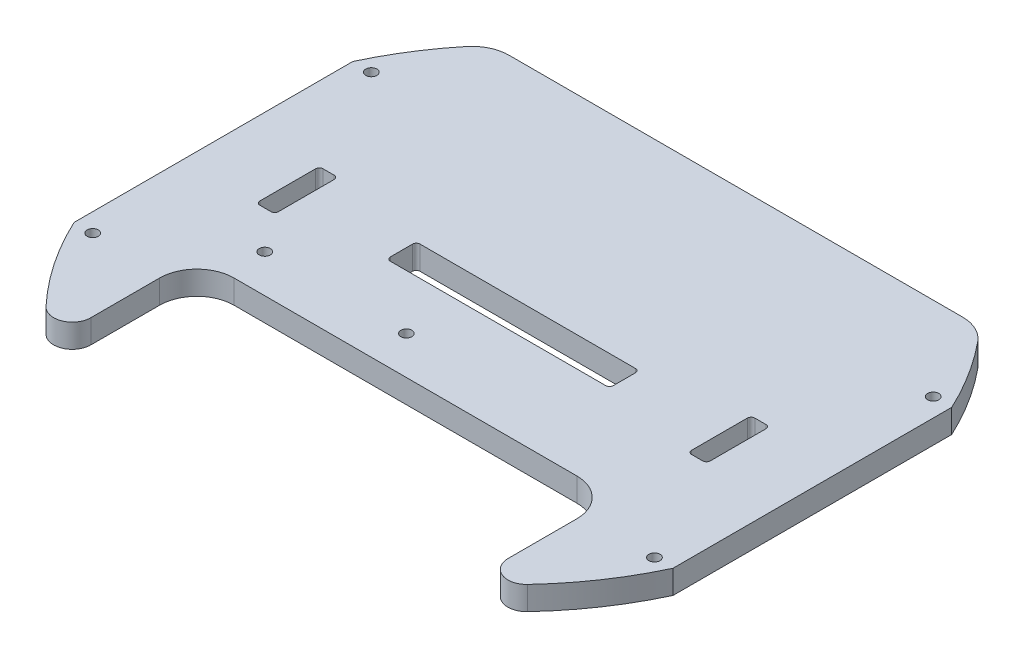
from build123d import *

# Parameters (mm, degrees)
MAIN_BODY_DEPTH    = 6.35
SKETCH6_R          = 1.524
FRONT_IR_DEPTH     = 121.168600308
SKETCH10_W         = 38.1
SKETCH10_H         = 25.908
GRABBER_SLOT_DEPTH = 121.168600308
SKETCH11_W         = 5
SKETCH11_H         = 17
SKETCH11_W_2       = 60
SKETCH11_H_2       = 8
WIRE_SLOTS_DEPTH   = 121.168600308
SKETCH13_R         = 1.5
F_2ND_LEVEL_DEPTH  = 121.168600308
CUT_EXTRUDE1_DEPTH = 121.168600308
FILLET1_R          = 5
FILLET2_R          = 10
CUT_EXTRUDE2_START = -10
CUT_EXTRUDE2_DEPTH = 10
FILLET3_R          = 10
FILLET4_R          = 1
SKETCH17_R         = 1.5
CUT_EXTRUDE3_DEPTH = 103.170168296


with BuildPart() as part:
    # Sketch1 → Main Body (new body)
    with BuildSketch(Plane(origin=(0, 0, 0), x_dir=(1, 0, 0), z_dir=(0, 1, 0))):
        with BuildLine():
            Line((-80.603721998, 37.5), (-80.603721998, -37.5))
            ThreePointArc((-80.603721998, -37.5), (0, -88.9), (80.603721998, -37.5))
            Line((80.603721998, -37.5), (80.603721998, 37.5))
            ThreePointArc((80.603721998, 37.5), (0, 88.9), (-80.603721998, 37.5))
        make_face()
    extrude(amount=MAIN_BODY_DEPTH)

    # Sketch6 → Front IR (cut, through all)
    with BuildSketch(Plane(origin=(0, 6.35, 0), x_dir=(1, 0, 0), z_dir=(0, 1, 0))):
        with Locations(Location((-12.7, -69.596, 0), (0, 0, 270))):
            Circle(SKETCH6_R)
        with Locations(Location((12.7, -69.596, 0), (0, 0, 270))):
            Circle(SKETCH6_R)
    extrude(amount=-FRONT_IR_DEPTH, mode=Mode.SUBTRACT)

    # Sketch10 → Grabber slot (cut, through all)
    with BuildSketch(Plane(origin=(0, 6.35, 0), x_dir=(1, 0, 0), z_dir=(0, 1, 0))):
        with Locations((0, -88.9)):
            Rectangle(SKETCH10_W, SKETCH10_H)
    extrude(amount=-GRABBER_SLOT_DEPTH, mode=Mode.SUBTRACT)

    # Sketch11 → Wire slots (cut, through all)
    with BuildSketch(Plane(origin=(0, 6.35, 0), x_dir=(1, 0, 0), z_dir=(0, 1, 0))):
        with Locations((-58.103721998, 0)):
            Rectangle(SKETCH11_W, SKETCH11_H)
        Rectangle(SKETCH11_W_2, SKETCH11_H_2)
        with Locations((58.103721998, 0)):
            Rectangle(SKETCH11_W, SKETCH11_H)
    extrude(amount=-WIRE_SLOTS_DEPTH, mode=Mode.SUBTRACT)

    # Sketch13 → 2nd level (cut, through all)
    with BuildSketch(Plane(origin=(0, 6.35, 0), x_dir=(1, 0, 0), z_dir=(0, 1, 0))):
        with Locations(Location((75.603721998, -37.5, 0), (0, 0, 270))):
            Circle(SKETCH13_R)
        with Locations(Location((-75.603721998, -37.5, 0), (0, 0, 270))):
            Circle(SKETCH13_R)
        with Locations(Location((75.603721998, 37.5, 0), (0, 0, 270))):
            Circle(SKETCH13_R)
        with Locations(Location((-75.603721998, 37.5, 0), (0, 0, 270))):
            Circle(SKETCH13_R)
    extrude(amount=-F_2ND_LEVEL_DEPTH, mode=Mode.SUBTRACT)

    # Sketch14 → Cut-Extrude1 (cut, through all)
    with BuildSketch(Plane(origin=(0, 6.35, 0), x_dir=(1, 0, 0), z_dir=(0, 1, 0))):
        with BuildLine():
            Line((56.134, -68.93608666), (56.134, -28.93608666))
            Line((56.134, -28.93608666), (-56.134, -28.93608666))
            Line((-56.134, -28.93608666), (-56.134, -68.93608666))
            ThreePointArc((-56.134, -68.93608666), (-38.642602624, -80.062221194), (-19.05, -86.834944003))
            Line((-19.05, -86.834944003), (-19.05, -75.946))
            Line((-19.05, -75.946), (19.05, -75.946))
            Line((19.05, -75.946), (19.05, -86.834944003))
            ThreePointArc((19.05, -86.834944003), (38.642602624, -80.062221194), (56.134, -68.93608666))
        make_face()
    extrude(amount=-CUT_EXTRUDE1_DEPTH, mode=Mode.SUBTRACT)

    # Fillet1
    fillet1_edges = [part.edges().sort_by_distance(p)[0] for p in [
        (56.134, 3.175, 68.93608666),
        (-56.134, 3.175, 68.93608666),
    ]]
    fillet(fillet1_edges, radius=FILLET1_R)

    # Fillet2
    fillet2_edges = [part.edges().sort_by_distance(p)[0] for p in [
        (-56.134, 3.175, 28.93608666),
        (56.134, 3.175, 28.93608666),
    ]]
    fillet(fillet2_edges, radius=FILLET2_R)

    # Sketch16 → Cut-Extrude2 (cut)
    with BuildSketch(Plane(origin=(0, 6.35, 0), x_dir=(1, 0, 0), z_dir=(0, 1, 0)).offset(CUT_EXTRUDE2_START)):
        with BuildLine():
            Line((65.598856697, 60), (-65.598856697, 60))
            ThreePointArc((-65.598856697, 60), (0, 88.9), (65.598856697, 60))
        make_face()
    extrude(amount=CUT_EXTRUDE2_DEPTH, mode=Mode.SUBTRACT)

    # Fillet3
    fillet3_edges = [part.edges().sort_by_distance(p)[0] for p in [
        (-65.598856697, 3.175, -60),
        (65.598856697, 3.175, -60),
    ]]
    fillet(fillet3_edges, radius=FILLET3_R)

    # Fillet4
    fillet4_edges = [part.edges().sort_by_distance(p)[0] for p in [
        (-30, 3.175, 4),
        (-30, 3.175, -4),
        (30, 3.175, -4),
        (30, 3.175, 4),
        (55.603721998, 3.175, 8.5),
        (55.603721998, 3.175, -8.5),
        (60.603721998, 3.175, -8.5),
        (60.603721998, 3.175, 8.5),
        (-60.603721998, 3.175, 8.5),
        (-60.603721998, 3.175, -8.5),
        (-55.603721998, 3.175, -8.5),
        (-55.603721998, 3.175, 8.5),
    ]]
    fillet(fillet4_edges, radius=FILLET4_R)

    # Sketch17 → Cut-Extrude3 (cut, through all)
    with BuildSketch(Plane(origin=(0, 6.35, 0), x_dir=(1, 0, 0), z_dir=(0, 1, 0))):
        with Locations(Location((-48.1, -18.678710205, 0), (0, 0, 270))):
            Circle(SKETCH17_R)
        with Locations(Location((-10, -18.678710205, 0), (0, 0, 270))):
            Circle(SKETCH17_R)
    extrude(amount=-CUT_EXTRUDE3_DEPTH, mode=Mode.SUBTRACT)


solid = part.part
